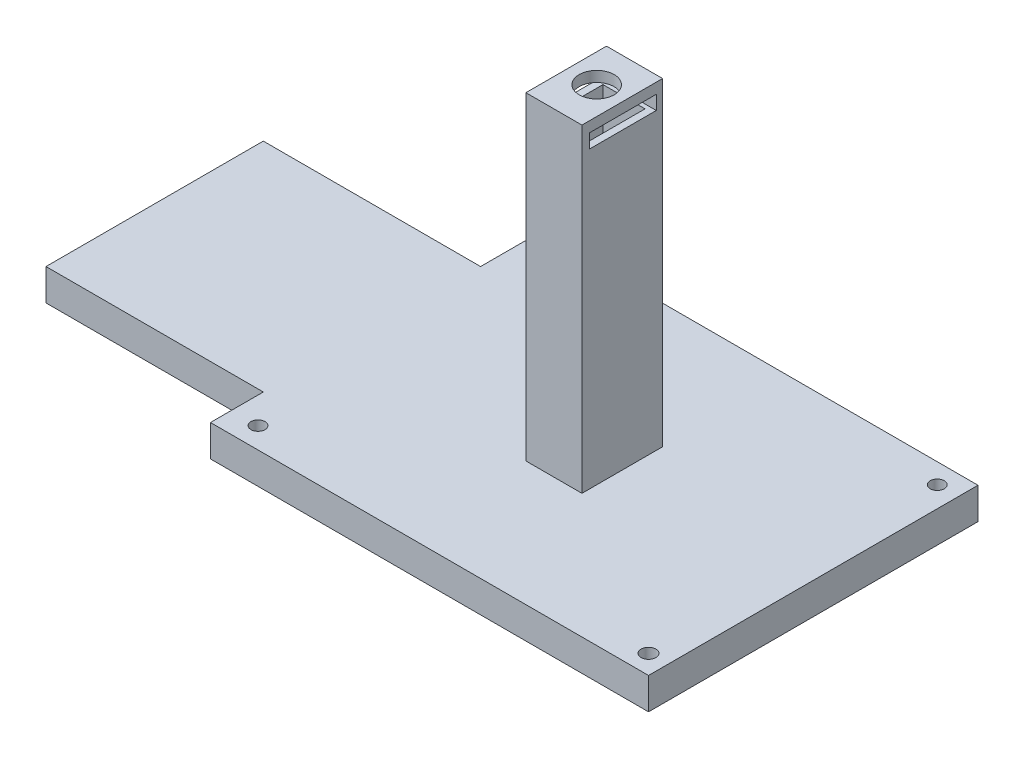
from build123d import *

# Parameters (mm, degrees)
SKETCH1_W           = 125
SKETCH1_H           = 94
BOSS_EXTRUDE2_DEPTH = 9
SKETCH2_W           = 16
SKETCH2_H           = 23
BOSS_EXTRUDE4_DEPTH = 100
SKETCH4_W           = 12
SKETCH4_H           = 17
CUT_EXTRUDE1_DEPTH  = 96.5
SKETCH5_R           = 5
CUT_EXTRUDE2_DEPTH  = 100
CUT_EXTRUDE3_START  = 8.777087
SKETCH6_W           = 19
SKETCH6_H           = 4
CUT_EXTRUDE3_DEPTH  = 100
SKETCH7_R           = 2
SKETCH7_R_2         = 2.002973214
SKETCH7_R_3         = 2.108586534
SKETCH7_R_4         = 2.000351704
CUT_EXTRUDE4_DEPTH  = 100
SKETCH8_W           = 62
SKETCH8_H           = 62
BOSS_EXTRUDE5_DEPTH = 9


with BuildPart() as part:
    # Sketch1 → Boss-Extrude2 (new body)
    with BuildSketch(Plane(origin=(0, 0, 0), x_dir=(1, 0, 0), z_dir=(0, 1, 0))):
        with Locations((0.777087034, -16.027531083)):
            Rectangle(SKETCH1_W, SKETCH1_H)
    extrude(amount=BOSS_EXTRUDE2_DEPTH)

    # Sketch2 → Boss-Extrude4 (add)
    with BuildSketch(Plane(origin=(0, 0, 0), x_dir=(1, 0, 0), z_dir=(0, 1, 0))):
        with Locations((0.777087034, -16.027531083)):
            Rectangle(SKETCH2_W, SKETCH2_H)
    extrude(amount=BOSS_EXTRUDE4_DEPTH)

    # Sketch4 → Cut-Extrude1 (cut)
    with BuildSketch(Plane(origin=(0, 0, 0), x_dir=(1, 0, 0), z_dir=(0, 1, 0))):
        with Locations((0.777087034, -16.027531083)):
            Rectangle(SKETCH4_W, SKETCH4_H)
    extrude(amount=CUT_EXTRUDE1_DEPTH, mode=Mode.SUBTRACT)

    # Sketch5 → Cut-Extrude2 (cut)
    with BuildSketch(Plane(origin=(0, 100, 0), x_dir=(1, 0, 0), z_dir=(0, 1, 0))):
        with Locations(Location((0.905359977, -15.45030284, 0), (0, 0, 270))):
            Circle(SKETCH5_R)
    extrude(amount=-CUT_EXTRUDE2_DEPTH, mode=Mode.SUBTRACT)

    # Sketch6 → Cut-Extrude3 (cut)
    with BuildSketch(Plane(origin=(0, 0, 0), x_dir=(0, 0, -1), z_dir=(1, 0, 0)).offset(CUT_EXTRUDE3_START)):
        with Locations((-15.823546724, 95)):
            Rectangle(SKETCH6_W, SKETCH6_H)
    extrude(amount=-CUT_EXTRUDE3_DEPTH, mode=Mode.SUBTRACT)

    # Sketch7 → Cut-Extrude4 (cut)
    with BuildSketch(Plane(origin=(0, 0, 0), x_dir=(1, 0, 0), z_dir=(0, 1, 0))):
        with Locations(Location((-54.512912966, 25.852468917, 0), (0, 0, 270))):
            Circle(SKETCH7_R)
        with Locations(Location((57.335663159, 25.288094206, 0), (0, 0, 270))):
            Circle(SKETCH7_R_2)
        with Locations(Location((57.809152834, -57.571905794, 0), (0, 0, 270))):
            Circle(SKETCH7_R_3)
        with Locations(Location((-54.169424944, -57.007531083, 0), (0, 0, 270))):
            Circle(SKETCH7_R_4)
    extrude(amount=CUT_EXTRUDE4_DEPTH, mode=Mode.SUBTRACT)

    # Sketch8 → Boss-Extrude5 (add)
    with BuildSketch(Plane(origin=(0, 0, 0), x_dir=(1, 0, 0), z_dir=(0, 1, 0))):
        with Locations((-92.722912966, -16.947525928)):
            Rectangle(SKETCH8_W, SKETCH8_H)
    extrude(amount=BOSS_EXTRUDE5_DEPTH)


solid = part.part
